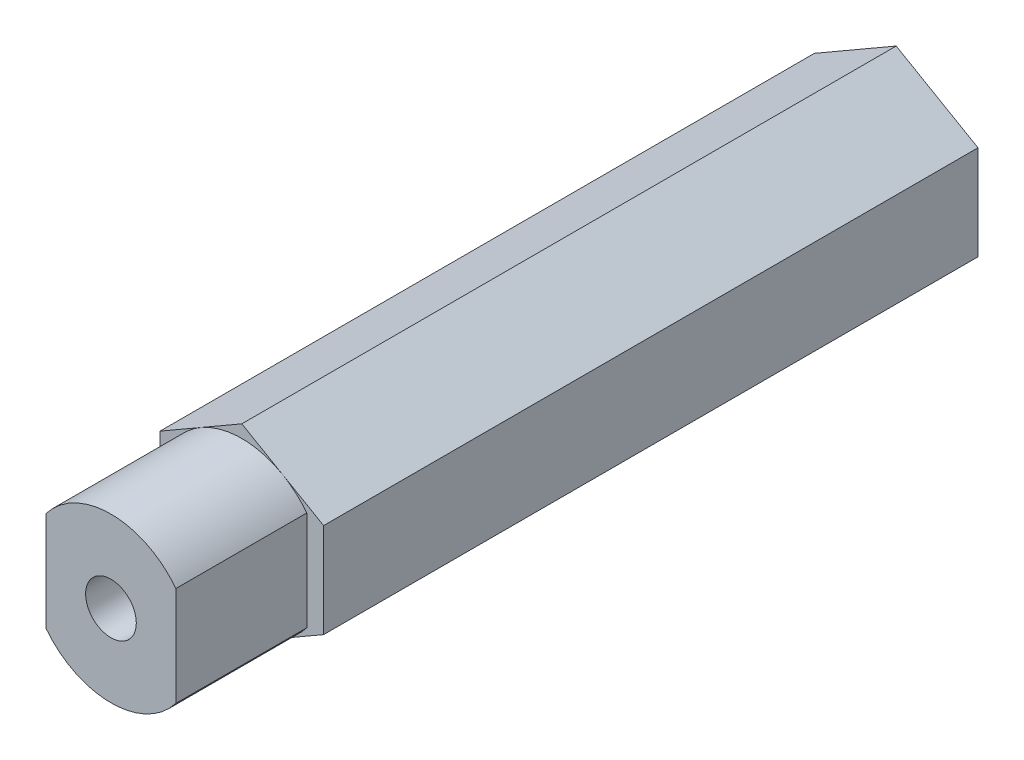
from build123d import *

# Parameters (mm, degrees)
BOSS_EXTRUDE1_DEPTH = 24
SKETCH4_R           = 1.55
CUT_EXTRUDE1_DEPTH  = 8


with BuildPart() as part:
    # Sketch3 → Boss-Extrude1 (new, symmetric)
    with BuildSketch(Plane.XY):
        Polygon((0, 5.773502692), (5, 2.886751346), (5, -2.886751346), (0, -5.773502692), (-5, -2.886751346), (-5, 2.886751346), align=None)
    extrude(amount=BOSS_EXTRUDE1_DEPTH, both=True)

    # Sketch4 → Cut-Extrude1 (cut)
    with BuildSketch(Plane.XY.offset(24)):
        with BuildLine():
            Line((-5, -2.886751346), (-2.500000044, -4.330126993))
            ThreePointArc((-2.500000044, -4.330126993), (-3.298726627, -3.757446293), (-3.97, -3.039588788))
            Line((-3.97, -3.039588788), (-3.97, 3.039588788))
            ThreePointArc((-3.97, 3.039588788), (-3.298726623, 3.757446296), (-2.500000037, 4.330126998))
            Line((-2.500000037, 4.330126998), (-5, 2.886751346))
            Line((-5, 2.886751346), (-5, -2.886751346))
        make_face()
        with BuildLine():
            ThreePointArc((-2.500000037, 4.330126998), (-7.5e-08, 5), (2.499999906, 4.330127073))
            Line((2.499999906, 4.330127073), (0, 5.773502692))
            Line((0, 5.773502692), (-2.500000037, 4.330126998))
        make_face()
        with BuildLine():
            Line((3.97, 3.039588788), (3.97, -3.039588788))
            ThreePointArc((3.97, -3.039588788), (3.298726555, -3.757446356), (2.499999878, -4.330127089))
            Line((2.499999878, -4.330127089), (5, -2.886751346))
            Line((5, -2.886751346), (5, 2.886751346))
            Line((5, 2.886751346), (2.499999906, 4.330127073))
            ThreePointArc((2.499999906, 4.330127073), (3.298726567, 3.757446345), (3.97, 3.039588788))
        make_face()
        with BuildLine():
            Line((0, -5.773502692), (2.499999878, -4.330127089))
            ThreePointArc((2.499999878, -4.330127089), (-9.6e-08, -5), (-2.500000044, -4.330126993))
            Line((-2.500000044, -4.330126993), (0, -5.773502692))
        make_face()
        Circle(SKETCH4_R)
    extrude(amount=-CUT_EXTRUDE1_DEPTH, mode=Mode.SUBTRACT)


solid = part.part
